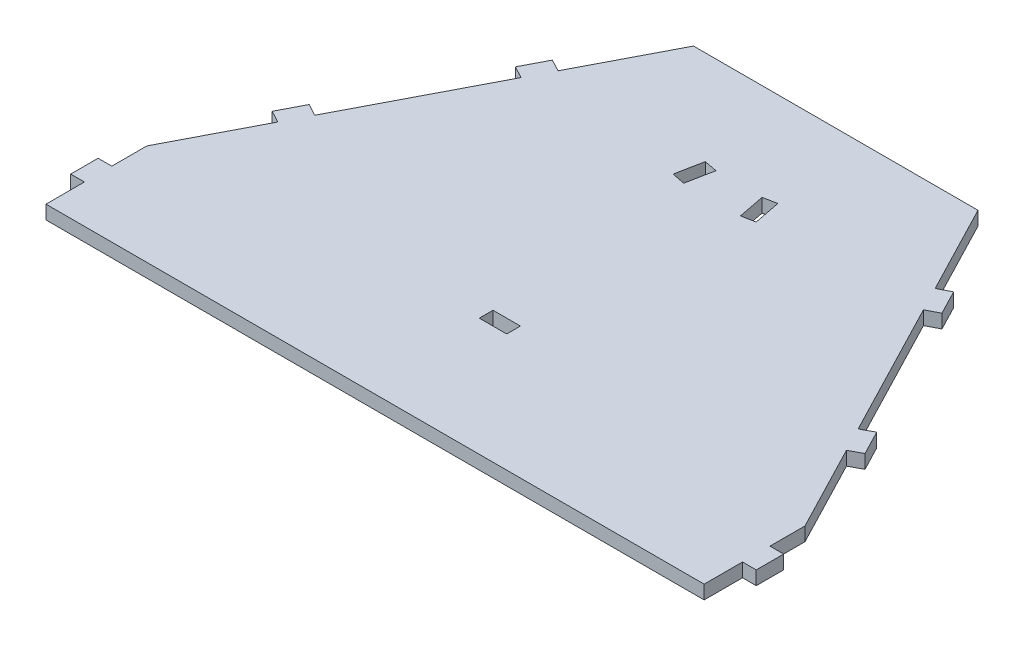
from build123d import *

# Parameters (mm, degrees)
BOSS_EXTRUDE1_DEPTH = 5
SKETCH2_W           = 5
SKETCH2_H           = 14
SKETCH2_W_2         = 10
SKETCH2_H_2         = 5
CUT_EXTRUDE1_DEPTH  = 210.418973113


with BuildPart() as part:
    # Sketch1 → Boss-Extrude1 (new body)
    with BuildSketch(Plane(origin=(0, 0, 0), x_dir=(1, 0, 0), z_dir=(0, 1, 0))):
        Polygon((-57.5, 167.947331922), (57.5, 167.947331922), (125, 37.947331922), (125, -0.052668078), (-125, -0.052668078), (-125, 37.947331922), align=None)
    extrude(amount=BOSS_EXTRUDE1_DEPTH)

    # Sketch2 → Cut-Extrude1 (cut, through all)
    with BuildSketch(Plane(origin=(0, 5, 0), x_dir=(1, 0, 0), z_dir=(0, 1, 0))):
        Polygon((-77.788864465, 128.872481842), (-103.476511391, 79.39997665), (-99.075067661, 77.027785029), (-73.843707474, 125.621215804), (-73.351788432, 126.56861544), align=None)
        Polygon((-125, 37.947331922), (-125, 23.947331922), (-120, 23.947331922), (-120, 36.728164098), (-103.683242772, 68.152835894), (-108.083917213, 70.526454327), align=None)
        with Locations((-122.5, 6.947331922)):
            Rectangle(SKETCH2_W, SKETCH2_H)
        with Locations((0, 45.447331922)):
            Rectangle(SKETCH2_W_2, SKETCH2_H_2)
        Polygon((-8.411070301, 132.656760174), (-13.226399097, 133.599762064), (-15.148227411, 123.786170675), (-10.332898614, 122.843168786), align=None)
        Polygon((10.332898614, 122.843168786), (15.148227411, 123.786170675), (13.226399097, 133.599762064), (8.411070301, 132.656760174), align=None)
        Polygon((-73.180711758, 137.74744261), (-68.74270223, 135.443091446), (-51.865499988, 167.947331922), (-57.5, 167.947331922), align=None)
        Polygon((73.351788432, 126.56861544), (73.843707474, 125.621215804), (99.075067661, 77.027785029), (103.476511391, 79.39997665), (77.788864465, 128.872481842), align=None)
        Polygon((68.74270223, 135.443091446), (73.180711758, 137.74744261), (57.5, 167.947331922), (51.865499988, 167.947331922), align=None)
        with Locations((122.5, 6.947331922)):
            Rectangle(SKETCH2_W, SKETCH2_H)
        Polygon((125, 23.947331922), (125, 37.947331922), (108.083917213, 70.526454327), (103.683242772, 68.152835894), (120, 36.728164098), (120, 23.947331922), align=None)
    extrude(amount=-CUT_EXTRUDE1_DEPTH, mode=Mode.SUBTRACT)


solid = part.part
